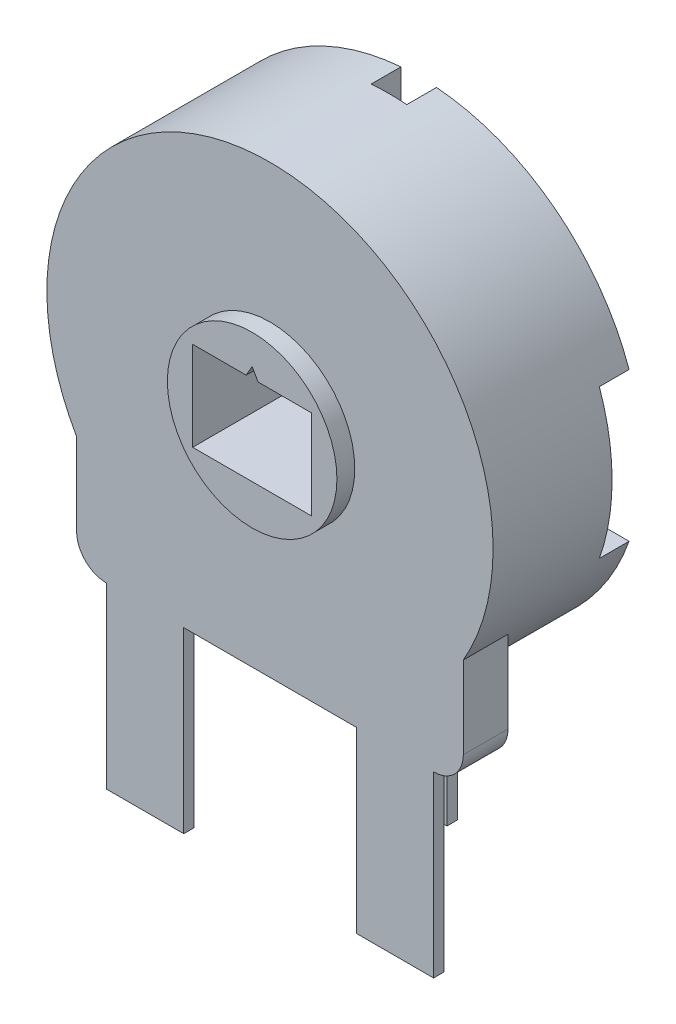
from build123d import *

# Parameters (mm, degrees)
SKETCH2_R           = 7.5
BOSS_EXTRUDE1_DEPTH = 5
SKETCH3_W           = 4
SKETCH3_H           = 3
CUT_EXTRUDE1_DEPTH  = 12.7260394
SKETCH4_R           = 3.85
CUT_EXTRUDE2_DEPTH  = 1
SKETCH7_R           = 2.85
BOSS_EXTRUDE2_DEPTH = 0.6
BOSS_EXTRUDE3_DEPTH = 1.5
SKETCH9_W           = 2.6
SKETCH9_H           = 0.35
BOSS_EXTRUDE4_DEPTH = 6


with BuildPart() as part:
    # Sketch2 → Boss-Extrude1 (new body)
    with BuildSketch(Plane.XY):
        Circle(SKETCH2_R)
    extrude(amount=BOSS_EXTRUDE1_DEPTH)

    # Sketch3 → Cut-Extrude1 (cut, through all)
    with BuildSketch(Plane(origin=(0, 0, 0), x_dir=(-1, 0, 0), z_dir=(0, 0, -1))):
        Polygon((0.302588522, 1.325300435), (0, 1.849399129), (-0.302588522, 1.325300435), align=None)
        Rectangle(SKETCH3_W, SKETCH3_H)
    extrude(amount=-CUT_EXTRUDE1_DEPTH, mode=Mode.SUBTRACT)

    # Sketch4 → Cut-Extrude2 (cut)
    # profile 1 of 9: a face of its own
    with BuildSketch(Plane(origin=(0, 0, 0), x_dir=(-1, 0, 0), z_dir=(0, 0, -1))):
        with BuildLine():
            Line((-7.071067812, -2.5), (-6, -2.5))
            ThreePointArc((-6, -2.5), (-6.5, 0), (-6, 2.5))
            Line((-6, 2.5), (-7.071067812, 2.5))
            ThreePointArc((-7.071067812, 2.5), (-7.5, 0), (-7.071067812, -2.5))
        make_face()
    # profile 2 of 9: a face of its own
    with BuildSketch(Plane(origin=(0, 0, 0), x_dir=(-1, 0, 0), z_dir=(0, 0, -1))):
        with BuildLine():
            Line((-6, -2.5), (-4.581631236, -2.5))
            Line((-4.581631236, -2.5), (-4.581631236, 2.5))
            Line((-4.581631236, 2.5), (-6, 2.5))
            ThreePointArc((-6, 2.5), (-6.5, 0), (-6, -2.5))
        make_face()
    # profile 3 of 9: a face of its own
    with BuildSketch(Plane(origin=(0, 0, 0), x_dir=(-1, 0, 0), z_dir=(0, 0, -1))):
        with BuildLine():
            Line((-4.581631236, 2.5), (-4.581631236, -2.5))
            Line((-4.581631236, -2.5), (-6, -2.5))
            ThreePointArc((-6, -2.5), (-3.850924227, -5.236447517), (-0.598372116, -6.472399154))
            Line((-0.598372116, -6.472399154), (-0.598372116, -5.084021936))
            Line((-0.598372116, -5.084021936), (0.598372116, -5.084021936))
            Line((0.598372116, -5.084021936), (0.598372116, -6.472399154))
            ThreePointArc((0.598372116, -6.472399154), (3.850924227, -5.236447517), (6, -2.5))
            Line((6, -2.5), (4.581631236, -2.5))
            Line((4.581631236, -2.5), (4.581631236, 2.5))
            Line((4.581631236, 2.5), (6, 2.5))
            ThreePointArc((6, 2.5), (3.850924227, 5.236447517), (0.598372116, 6.472399154))
            Line((0.598372116, 6.472399154), (0.598372116, 4.979496746))
            Line((0.598372116, 4.979496746), (-0.598372116, 4.979496746))
            Line((-0.598372116, 4.979496746), (-0.598372116, 6.472399154))
            ThreePointArc((-0.598372116, 6.472399154), (-3.850924227, 5.236447517), (-6, 2.5))
            Line((-6, 2.5), (-4.581631236, 2.5))
        make_face()
        Circle(SKETCH4_R, mode=Mode.SUBTRACT)
    # profile 4 of 9: a face of its own
    with BuildSketch(Plane(origin=(0, 0, 0), x_dir=(-1, 0, 0), z_dir=(0, 0, -1))):
        with BuildLine():
            ThreePointArc((0.598372116, 6.472399154), (0, 6.5), (-0.598372116, 6.472399154))
            Line((-0.598372116, 6.472399154), (-0.598372116, 4.979496746))
            Line((-0.598372116, 4.979496746), (0.598372116, 4.979496746))
            Line((0.598372116, 4.979496746), (0.598372116, 6.472399154))
        make_face()
    # profile 5 of 9: a face of its own
    with BuildSketch(Plane(origin=(0, 0, 0), x_dir=(-1, 0, 0), z_dir=(0, 0, -1))):
        with BuildLine():
            Line((-0.598372116, 7.476091948), (-0.598372116, 6.472399154))
            ThreePointArc((-0.598372116, 6.472399154), (0, 6.5), (0.598372116, 6.472399154))
            Line((0.598372116, 6.472399154), (0.598372116, 7.476091948))
            ThreePointArc((0.598372116, 7.476091948), (0, 7.5), (-0.598372116, 7.476091948))
        make_face()
    # profile 6 of 9: a face of its own
    with BuildSketch(Plane(origin=(0, 0, 0), x_dir=(-1, 0, 0), z_dir=(0, 0, -1))):
        with BuildLine():
            Line((4.581631236, -2.5), (6, -2.5))
            ThreePointArc((6, -2.5), (6.373774392, -1.274754878), (6.5, 0))
            ThreePointArc((6.5, 0), (6.373774392, 1.274754878), (6, 2.5))
            Line((6, 2.5), (4.581631236, 2.5))
            Line((4.581631236, 2.5), (4.581631236, -2.5))
        make_face()
    # profile 7 of 9: a face of its own
    with BuildSketch(Plane(origin=(0, 0, 0), x_dir=(-1, 0, 0), z_dir=(0, 0, -1))):
        with BuildLine():
            ThreePointArc((6.5, 0), (6.373774392, -1.274754878), (6, -2.5))
            Line((6, -2.5), (7.071067812, -2.5))
            ThreePointArc((7.071067812, -2.5), (7.391989197, -1.26826484), (7.5, 0))
            ThreePointArc((7.5, 0), (7.391989197, 1.26826484), (7.071067812, 2.5))
            Line((7.071067812, 2.5), (6, 2.5))
            ThreePointArc((6, 2.5), (6.373774392, 1.274754878), (6.5, 0))
        make_face()
    # profile 8 of 9: a face of its own
    with BuildSketch(Plane(origin=(0, 0, 0), x_dir=(-1, 0, 0), z_dir=(0, 0, -1))):
        with BuildLine():
            Line((-0.598372116, -5.084021936), (-0.598372116, -6.472399154))
            ThreePointArc((-0.598372116, -6.472399154), (0, -6.5), (0.598372116, -6.472399154))
            Line((0.598372116, -6.472399154), (0.598372116, -5.084021936))
            Line((0.598372116, -5.084021936), (-0.598372116, -5.084021936))
        make_face()
    # profile 9 of 9: a face of its own
    with BuildSketch(Plane(origin=(0, 0, 0), x_dir=(-1, 0, 0), z_dir=(0, 0, -1))):
        with BuildLine():
            ThreePointArc((0.598372116, -6.472399154), (0, -6.5), (-0.598372116, -6.472399154))
            Line((-0.598372116, -6.472399154), (-0.598372116, -7.476091948))
            ThreePointArc((-0.598372116, -7.476091948), (0, -7.5), (0.598372116, -7.476091948))
            Line((0.598372116, -7.476091948), (0.598372116, -6.472399154))
        make_face()
    extrude(amount=-CUT_EXTRUDE2_DEPTH, mode=Mode.SUBTRACT)

    # Sketch7 → Boss-Extrude2 (add)
    with BuildSketch(Plane.XY.offset(5)):
        Circle(SKETCH7_R)
        Polygon((2, -1.5), (-2, -1.5), (-2, 1.5), (-0.201725681, 1.5), (0, 1.849399129), (0.201725681, 1.5), (2, 1.5), align=None, mode=Mode.SUBTRACT)
    extrude(amount=BOSS_EXTRUDE2_DEPTH)

    # Sketch8 → Boss-Extrude3 (add)
    with BuildSketch(Plane.XY.offset(5)):
        with BuildLine():
            Line((-5.5, -7.5), (5.5, -7.5))
            ThreePointArc((5.5, -7.5), (6.207106781, -7.207106781), (6.5, -6.5))
            Line((6.5, -6.5), (6.5, -2.85))
            Line((6.5, -2.85), (-6.5, -2.85))
            Line((-6.5, -2.85), (-6.5, -6.5))
            ThreePointArc((-6.5, -6.5), (-6.207106781, -7.207106781), (-5.5, -7.5))
        make_face()
    extrude(amount=-BOSS_EXTRUDE3_DEPTH)

    # Sketch9 → Boss-Extrude4 (add)
    with BuildSketch(Plane.XZ.offset(7.5)):
        with Locations((0, 0.175)):
            Rectangle(SKETCH9_W, SKETCH9_H)
        with Locations((-4.2, 4.825)):
            Rectangle(SKETCH9_W, SKETCH9_H)
        with Locations((4.2, 4.825)):
            Rectangle(SKETCH9_W, SKETCH9_H)
    extrude(amount=BOSS_EXTRUDE4_DEPTH)


with BuildPart() as boss_extrude4_piece_1:
    # of the separate pieces the step leaves, piece 1, a body of its own (boss_extrude4_pieces)
    add(part.part.solids().sort_by_distance((7.071067812, 2.5, 0))[0])


with BuildPart() as boss_extrude4_piece_2:
    # of the separate pieces the step leaves, piece 2, a body of its own (boss_extrude4_pieces)
    add(part.part.solids().sort_by_distance((-1.3, -7.5, 0))[0])


solid = Compound([boss_extrude4_piece_1.part, boss_extrude4_piece_2.part])
